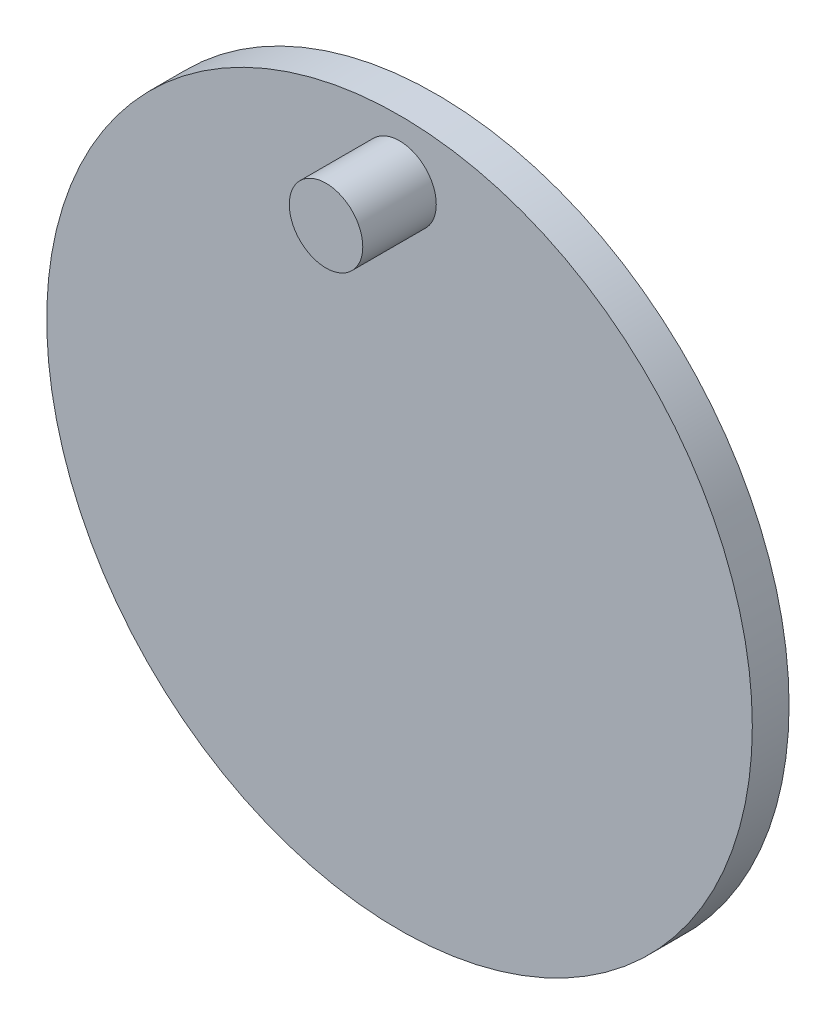
from build123d import *

# Parameters (mm, degrees)
ESBO_O1_R                = 48
RESSALTO_EXTRUS_O1_DEPTH = 5
ESBO_O2_R                = 5
RESSALTO_EXTRUS_O2_DEPTH = 15
ESBO_O3_R                = 10
RESSALTO_EXTRUS_O4_DEPTH = 10


with BuildPart() as part:
    # Esboço1 → Ressalto-extrusão1 (new body)
    with BuildSketch(Plane.XY):
        Circle(ESBO_O1_R)
    extrude(amount=RESSALTO_EXTRUS_O1_DEPTH)

    # Esboço2 → Ressalto-extrusão2 (add)
    with BuildSketch(Plane.XY):
        with Locations((0, 40)):
            Circle(ESBO_O2_R)
    extrude(amount=RESSALTO_EXTRUS_O2_DEPTH)

    # Esboço3 → Ressalto-extrusão4 (add)
    with BuildSketch(Plane(origin=(0, 0, 0), x_dir=(-1, 0, 0), z_dir=(0, 0, -1))):
        Circle(ESBO_O3_R)
    extrude(amount=RESSALTO_EXTRUS_O4_DEPTH)


solid = part.part
